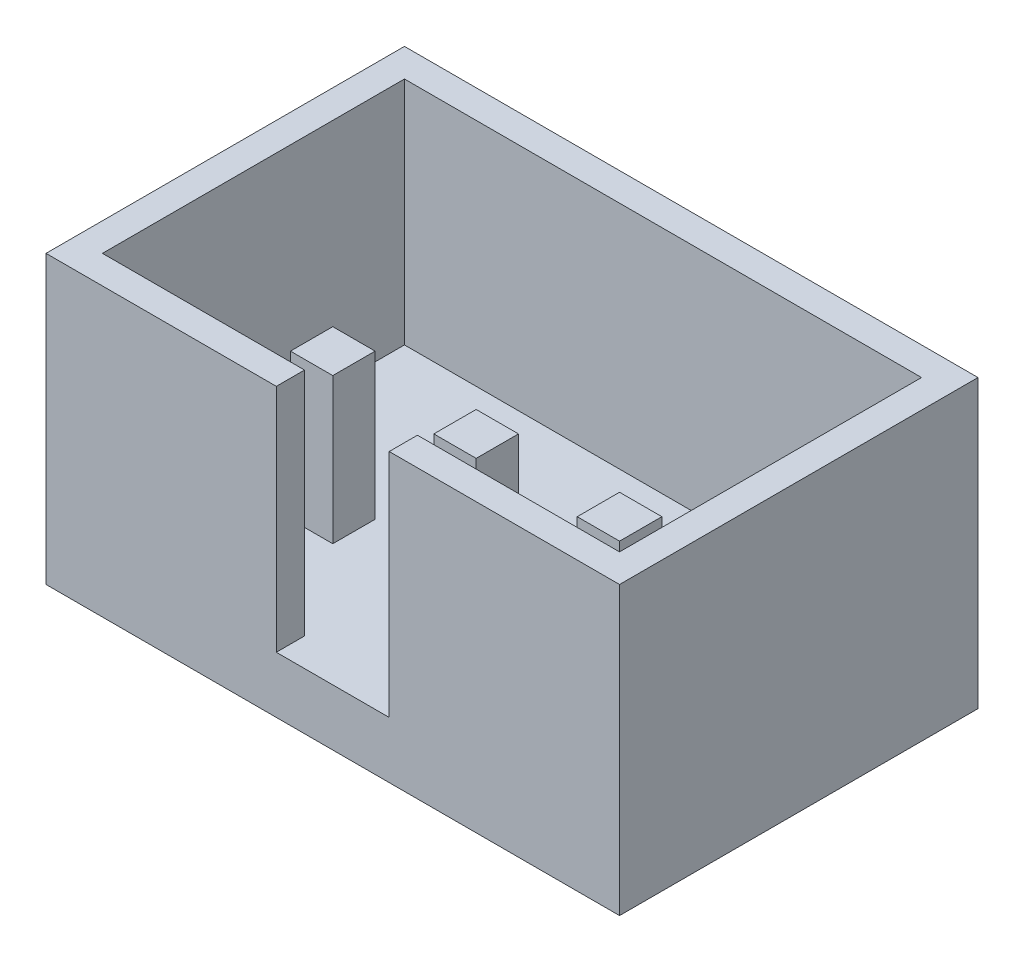
from build123d import *

# Parameters (mm, degrees)
SKETCH_1_W           = 10.16
SKETCH_1_H           = 6.35
EXTRUDE_1_DEPTH      = 5.08
SKETCH_2_W           = 9.16
SKETCH_2_H           = 5.35
CUT_EXTRUDE_1_DEPTH  = 4.08
SKETCH_3_W           = 2
SKETCH_3_H           = 4.08
CUT_EXTRUDE_2_DEPTH  = 1
EXTRUDE_2_DEPTH      = 2
EXTRUDE_2_DEPTH_BACK = 3.58
SKETCH_4_W           = 0.75
SKETCH_4_H           = 0.75


with BuildPart() as part:
    # 草图1 → 拉伸1 (new body)
    with BuildSketch(Plane(origin=(0, 0, 0), x_dir=(1, 0, 0), z_dir=(0, 1, 0))):
        Rectangle(SKETCH_1_W, SKETCH_1_H)
    extrude(amount=EXTRUDE_1_DEPTH)

    # 草图2 → 切除-拉伸1 (cut)
    with BuildSketch(Plane(origin=(0, 5.08, 0), x_dir=(-1, 0, 0), z_dir=(0, 1, 0))):
        Rectangle(SKETCH_2_W, SKETCH_2_H)
    extrude(amount=-CUT_EXTRUDE_1_DEPTH, mode=Mode.SUBTRACT)

    # 草图3 → 切除-拉伸2 (cut)
    with BuildSketch(Plane.XY.offset(3.175)):
        with Locations((0, 3.04)):
            Rectangle(SKETCH_3_W, SKETCH_3_H)
    extrude(amount=-CUT_EXTRUDE_2_DEPTH, mode=Mode.SUBTRACT)

    # 草图4 → 拉伸2 (add, two sides: drawn at the far end of the back side and taken through both)
    with BuildSketch(Plane.XZ.offset(-EXTRUDE_2_DEPTH_BACK)):
        with Locations((0, 0.635)):
            Rectangle(SKETCH_4_W, SKETCH_4_H)
        with Locations((2.54, 0.635)):
            Rectangle(SKETCH_4_W, SKETCH_4_H)
        with Locations((-2.54, 0.635)):
            Rectangle(SKETCH_4_W, SKETCH_4_H)
    extrude(amount=EXTRUDE_2_DEPTH + EXTRUDE_2_DEPTH_BACK)


solid = part.part
